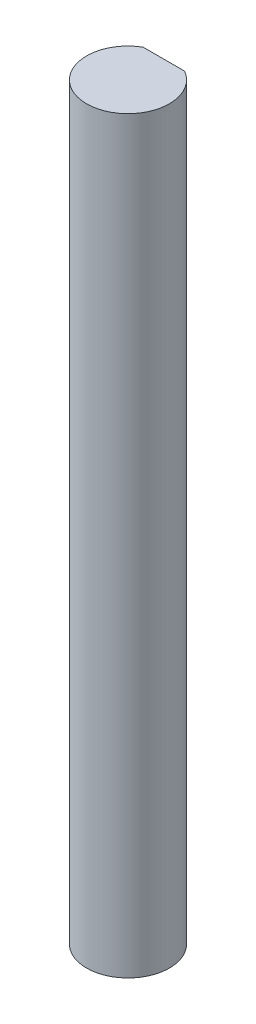
from build123d import *

# Parameters (mm, degrees)
BOSS_EXTRUDE1_DEPTH      = 43
BOSS_EXTRUDE1_DEPTH_BACK = 43


with BuildPart() as part:
    # Sketch1 → Boss-Extrude1 (new, two sides: drawn at the far end of the back side and taken through both)
    with BuildSketch(Plane(origin=(0, 0, 0), x_dir=(1, 0, 0), z_dir=(0, 1, 0)).offset(-BOSS_EXTRUDE1_DEPTH_BACK)):
        with BuildLine():
            Line((2.3876, 4.120773288), (-2.3876, 4.120773288))
            ThreePointArc((-2.3876, 4.120773288), (-2.378072881, -4.126278665), (4.7625, 0))
            ThreePointArc((4.7625, 0), (4.126278665, 2.378072881), (2.3876, 4.120773288))
        make_face()
    extrude(amount=BOSS_EXTRUDE1_DEPTH + BOSS_EXTRUDE1_DEPTH_BACK)


solid = part.part
